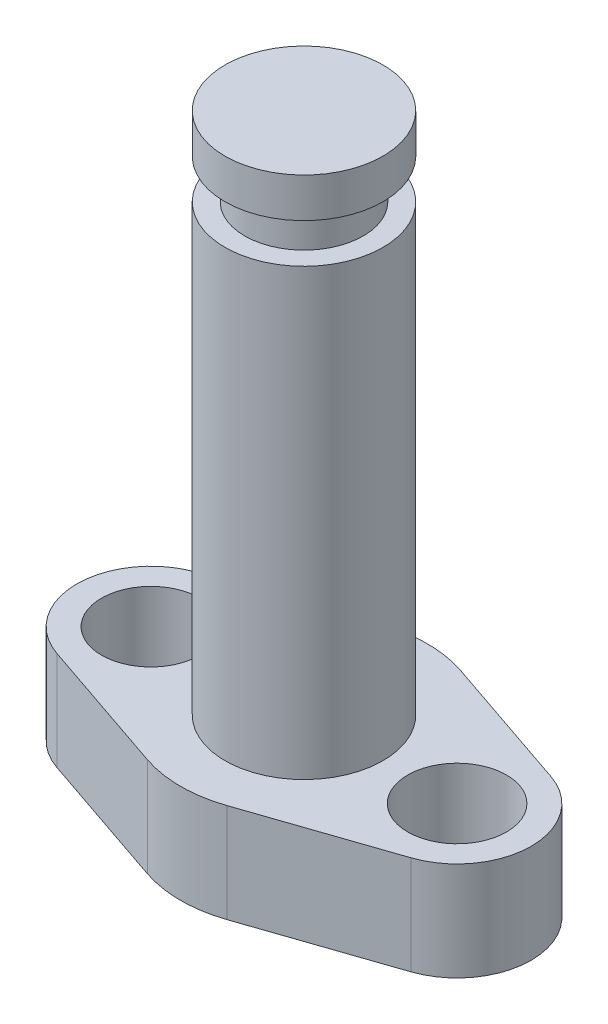
from build123d import *

# Parameters (mm, degrees)
SKETCH1_R           = 2.5
BOSS_EXTRUDE1_DEPTH = 5
SKETCH2_R           = 4
BOSS_EXTRUDE2_DEPTH = 22.5
SKETCH3_R           = 3
BOSS_EXTRUDE3_DEPTH = 2
SKETCH4_R           = 4
BOSS_EXTRUDE4_DEPTH = 2


with BuildPart() as part:
    # Sketch1 → Boss-Extrude1 (new body)
    with BuildSketch(Plane(origin=(0, 0, 0), x_dir=(1, 0, 0), z_dir=(0, 1, 0))):
        with BuildLine():
            ThreePointArc((-2.016129032, -5.9158874), (0, -6.25), (2.016129032, -5.9158874))
            Line((2.016129032, -5.9158874), (8.959677419, -3.54953244))
            ThreePointArc((8.959677419, -3.54953244), (11.5, 0), (8.959677419, 3.54953244))
            Line((8.959677419, 3.54953244), (2.016129032, 5.9158874))
            ThreePointArc((2.016129032, 5.9158874), (0, 6.25), (-2.016129032, 5.9158874))
            Line((-2.016129032, 5.9158874), (-8.959677419, 3.54953244))
            ThreePointArc((-8.959677419, 3.54953244), (-11.5, 0), (-8.959677419, -3.54953244))
            Line((-8.959677419, -3.54953244), (-2.016129032, -5.9158874))
        make_face()
        with Locations(Location((-7.75, 0, 0), (0, 0, 270))):
            Circle(SKETCH1_R, mode=Mode.SUBTRACT)
        with Locations(Location((7.75, 0, 0), (0, 0, 270))):
            Circle(SKETCH1_R, mode=Mode.SUBTRACT)
    extrude(amount=BOSS_EXTRUDE1_DEPTH)

    # Sketch2 → Boss-Extrude2 (add)
    with BuildSketch(Plane(origin=(0, 5, 0), x_dir=(1, 0, 0), z_dir=(0, 1, 0))):
        with Locations(Location((0, 0, 0), (0, 0, 90))):
            Circle(SKETCH2_R)
    extrude(amount=BOSS_EXTRUDE2_DEPTH)

    # Sketch3 → Boss-Extrude3 (add)
    with BuildSketch(Plane(origin=(0, 27.5, 0), x_dir=(1, 0, 0), z_dir=(0, 1, 0))):
        with Locations(Location((0, 0, 0), (0, 0, 270))):
            Circle(SKETCH3_R)
    extrude(amount=BOSS_EXTRUDE3_DEPTH)

    # Sketch4 → Boss-Extrude4 (add)
    with BuildSketch(Plane(origin=(0, 29.5, 0), x_dir=(1, 0, 0), z_dir=(0, 1, 0))):
        with Locations(Location((0, 0, 0), (0, 0, 90))):
            Circle(SKETCH4_R)
    extrude(amount=BOSS_EXTRUDE4_DEPTH)


solid = part.part
